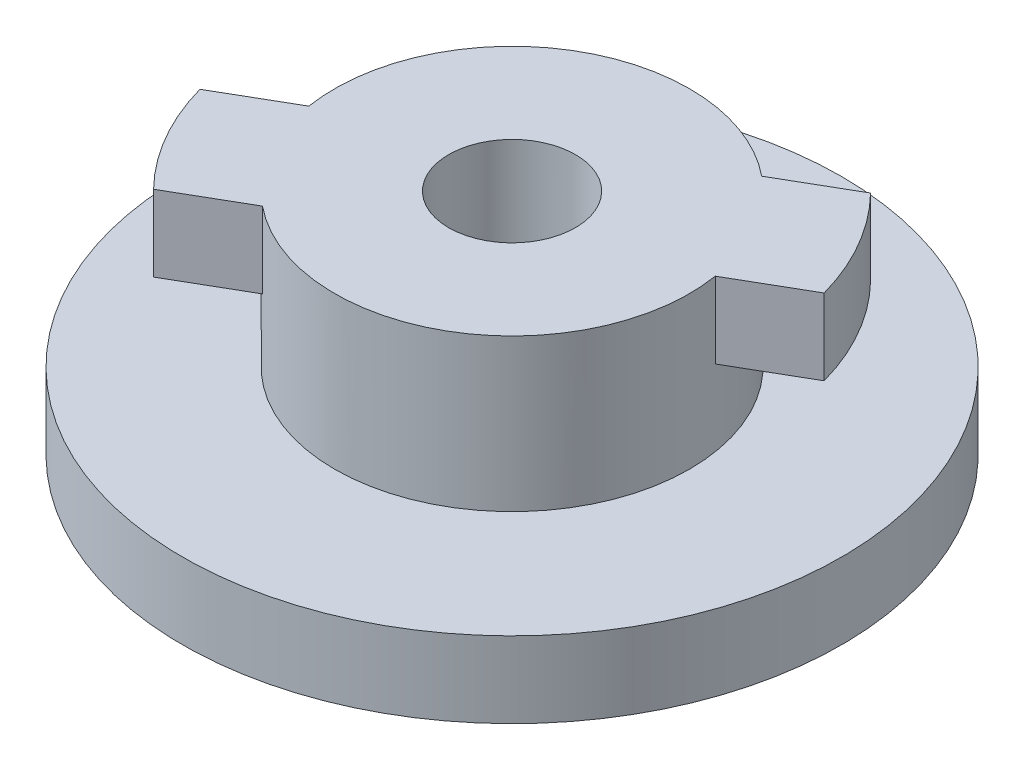
from build123d import *

# Parameters (mm, degrees)
BOSS_EXTRUDE1_DEPTH = 3
BOSS_EXTRUDE2_START = 3
SKETCH2_R           = 7
BOSS_EXTRUDE2_DEPTH = 3
SKETCH3_R           = 13
BOSS_EXTRUDE3_DEPTH = 3
SKETCH4_R           = 2.5
CUT_EXTRUDE1_DEPTH  = 20


with BuildPart() as part:
    # Sketch1 → Boss-Extrude1 (new body)
    with BuildSketch(Plane(origin=(0, 0, 0), x_dir=(-1, 0, 0), z_dir=(0, 1, 0))):
        with BuildLine():
            Line((4.412375826, -57.65977305), (7.135254916, -56.087718075))
            ThreePointArc((7.135254916, -56.087718075), (8.660254038, -58.094010768), (9.635254916, -60.417845094))
            Line((9.635254916, -60.417845094), (6.912375826, -61.989900069))
            ThreePointArc((6.912375826, -61.989900069), (3.5, -69.156188594), (-4.412375826, -68.528248485))
            Line((-4.412375826, -68.528248485), (-7.135254916, -70.10030346))
            ThreePointArc((-7.135254916, -70.10030346), (-8.660254038, -68.094010768), (-9.635254916, -65.770176441))
            Line((-9.635254916, -65.770176441), (-6.912375826, -64.198121466))
            ThreePointArc((-6.912375826, -64.198121466), (-3.5, -57.031832941), (4.412375826, -57.65977305))
        make_face()
    extrude(amount=BOSS_EXTRUDE1_DEPTH)

    # Sketch2 → Boss-Extrude2 (add)
    with BuildSketch(Plane.XZ.offset(BOSS_EXTRUDE2_START)):
        with Locations(Location((0, -63.094010768, 0), (0, 0, 270))):
            Circle(SKETCH2_R)
    extrude(amount=-BOSS_EXTRUDE2_DEPTH)

    # Sketch3 → Boss-Extrude3 (add)
    with BuildSketch(Plane.XZ.offset(3)):
        with Locations(Location((0, -63.094010768, 0), (0, 0, 270))):
            Circle(SKETCH3_R)
    extrude(amount=BOSS_EXTRUDE3_DEPTH)

    # Sketch4 → Cut-Extrude1 (cut)
    with BuildSketch(Plane(origin=(0, 3, 0), x_dir=(1, 0, 0), z_dir=(0, 1, 0))):
        with Locations(Location((0, 63.094010768, 0), (0, 0, 270))):
            Circle(SKETCH4_R)
    extrude(amount=-CUT_EXTRUDE1_DEPTH, mode=Mode.SUBTRACT)


solid = part.part
